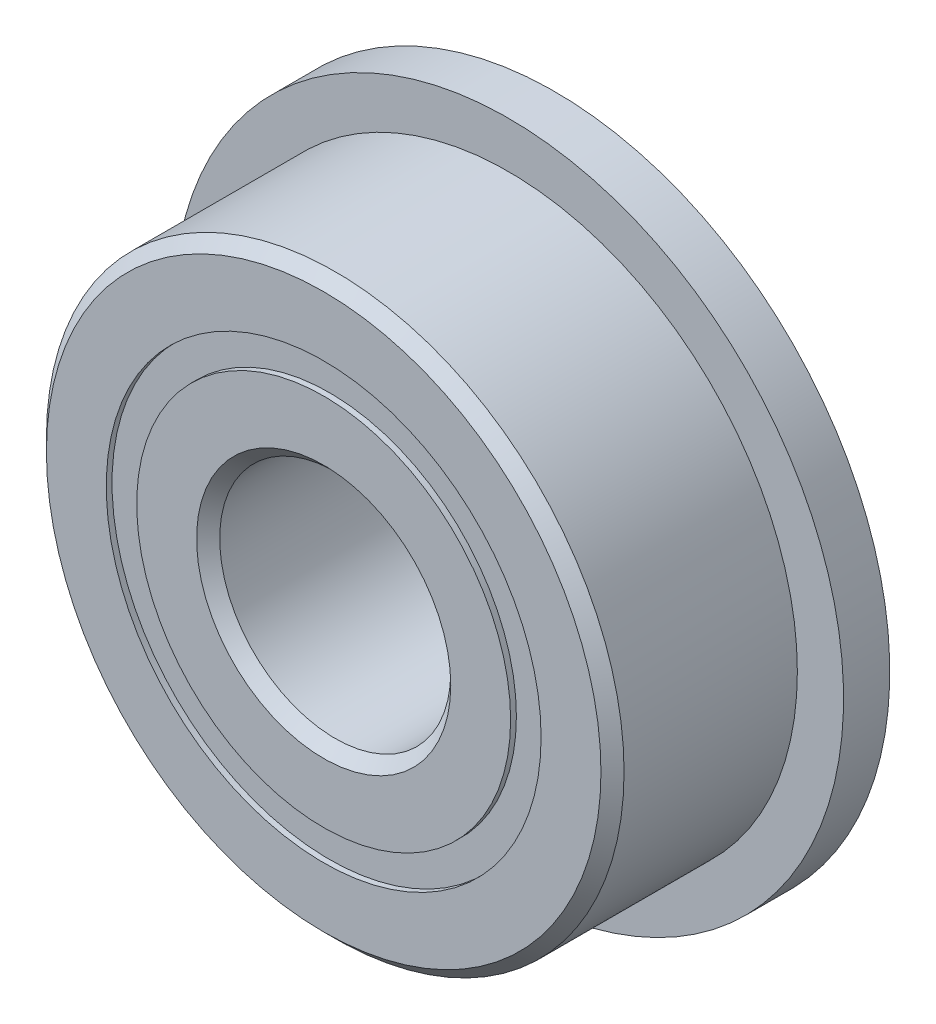
from build123d import *

# Parameters (mm, degrees)
CIRPATTERN1_COUNT = 12
SKETCH5_W         = 0.972810551
SKETCH5_H         = 0.527472528
SKETCH6_W         = 0.8
SKETCH6_H         = 2.036263736


with BuildPart() as part:
    # Sketch1 → Revolve1 (revolve)
    with BuildSketch(Plane(origin=(0, 0, 0), x_dir=(0, 0, -1), z_dir=(1, 0, 0))):
        with BuildLine():
            Line((1.8, 5), (-1.8, 5))
            Line((-1.8, 5), (-2, 4.8))
            Line((-2, 4.8), (-2, 3.763736264))
            Line((-2, 3.763736264), (-0.888888889, 3.763736264))
            ThreePointArc((-0.888888889, 3.763736264), (0, 4.427189449), (0.888888889, 3.763736264))
            Line((0.888888889, 3.763736264), (2, 3.763736264))
            Line((2, 3.763736264), (2, 4.8))
            Line((2, 4.8), (1.8, 5))
        make_face()
    revolve(axis=Axis((0, 0, 2), (0, 0, -1)))

    # Sketch6 → Revolve6 (revolve)
    with BuildSketch(Plane(origin=(0, 0, 0), x_dir=(0, 0, -1), z_dir=(1, 0, 0))):
        with Locations((1.6, 4.781868132)):
            Rectangle(SKETCH6_W, SKETCH6_H)
    revolve(axis=Axis((0, 0, -2), (0, 0, 1)))


with BuildPart() as body_2:
    # Sketch3 → Revolve3 (revolve)
    with BuildSketch(Plane(origin=(0, 0, 0), x_dir=(0, 0, -1), z_dir=(1, 0, 0))):
        with BuildLine():
            Line((-2, 3.236263736), (-0.888888889, 3.236263736))
            ThreePointArc((-0.888888889, 3.236263736), (0, 2.572810551), (0.888888889, 3.236263736))
            Line((0.888888889, 3.236263736), (2, 3.236263736))
            Line((2, 3.236263736), (2, 2.2))
            Line((2, 2.2), (1.8, 2))
            Line((1.8, 2), (-1.8, 2))
            Line((-1.8, 2), (-2, 2.2))
            Line((-2, 2.2), (-2, 3.236263736))
        make_face()
    revolve(axis=Axis((0, 0, 2), (0, 0, -1)))


with BuildPart() as body_3:
    # Sketch4 → Revolve4 (revolve)
    with BuildSketch(Plane(origin=(0, 0, 0), x_dir=(0, 0, -1), z_dir=(1, 0, 0))):
        with BuildLine():
            Line((-0.927189449, 3.5), (0.927189449, 3.5))
            ThreePointArc((0.927189449, 3.5), (0, 4.427189449), (-0.927189449, 3.5))
        make_face()
    revolve(axis=Axis((0, 3.5, 0.927189449), (0, 0, -1)))


with BuildPart() as cirpattern1_1:
    # CirPattern1: pattern copy
    add(body_3.part.rotate(Axis((0, 0, -2), (0, 0, 1)), 1 * 360 / CIRPATTERN1_COUNT))


with BuildPart() as cirpattern1_2:
    # CirPattern1: pattern copy
    add(body_3.part.rotate(Axis((0, 0, -2), (0, 0, 1)), 2 * 360 / CIRPATTERN1_COUNT))


with BuildPart() as cirpattern1_3:
    # CirPattern1: pattern copy
    add(body_3.part.rotate(Axis((0, 0, -2), (0, 0, 1)), 3 * 360 / CIRPATTERN1_COUNT))


with BuildPart() as cirpattern1_4:
    # CirPattern1: pattern copy
    add(body_3.part.rotate(Axis((0, 0, -2), (0, 0, 1)), 4 * 360 / CIRPATTERN1_COUNT))


with BuildPart() as cirpattern1_5:
    # CirPattern1: pattern copy
    add(body_3.part.rotate(Axis((0, 0, -2), (0, 0, 1)), 5 * 360 / CIRPATTERN1_COUNT))


with BuildPart() as cirpattern1_6:
    # CirPattern1: pattern copy
    add(body_3.part.rotate(Axis((0, 0, -2), (0, 0, 1)), 6 * 360 / CIRPATTERN1_COUNT))


with BuildPart() as cirpattern1_7:
    # CirPattern1: pattern copy
    add(body_3.part.rotate(Axis((0, 0, -2), (0, 0, 1)), 7 * 360 / CIRPATTERN1_COUNT))


with BuildPart() as cirpattern1_8:
    # CirPattern1: pattern copy
    add(body_3.part.rotate(Axis((0, 0, -2), (0, 0, 1)), 8 * 360 / CIRPATTERN1_COUNT))


with BuildPart() as cirpattern1_9:
    # CirPattern1: pattern copy
    add(body_3.part.rotate(Axis((0, 0, -2), (0, 0, 1)), 9 * 360 / CIRPATTERN1_COUNT))


with BuildPart() as cirpattern1_10:
    # CirPattern1: pattern copy
    add(body_3.part.rotate(Axis((0, 0, -2), (0, 0, 1)), 10 * 360 / CIRPATTERN1_COUNT))


with BuildPart() as cirpattern1_11:
    # CirPattern1: pattern copy
    add(body_3.part.rotate(Axis((0, 0, -2), (0, 0, 1)), 11 * 360 / CIRPATTERN1_COUNT))


with BuildPart() as body_15:
    # Sketch5 → Revolve5 (revolve)
    with BuildSketch(Plane(origin=(0, 0, 0), x_dir=(0, 0, -1), z_dir=(1, 0, 0))):
        with Locations((-1.413594725, 3.5)):
            Rectangle(SKETCH5_W, SKETCH5_H)
        with Locations((1.413594725, 3.5)):
            Rectangle(SKETCH5_W, SKETCH5_H)
    revolve(axis=Axis((0, 0, 2), (0, 0, -1)))


solid = Compound([part.part, body_2.part, body_3.part, cirpattern1_1.part, cirpattern1_2.part, cirpattern1_3.part, cirpattern1_4.part, cirpattern1_5.part, cirpattern1_6.part, cirpattern1_7.part, cirpattern1_8.part, cirpattern1_9.part, cirpattern1_10.part, cirpattern1_11.part, body_15.part])
